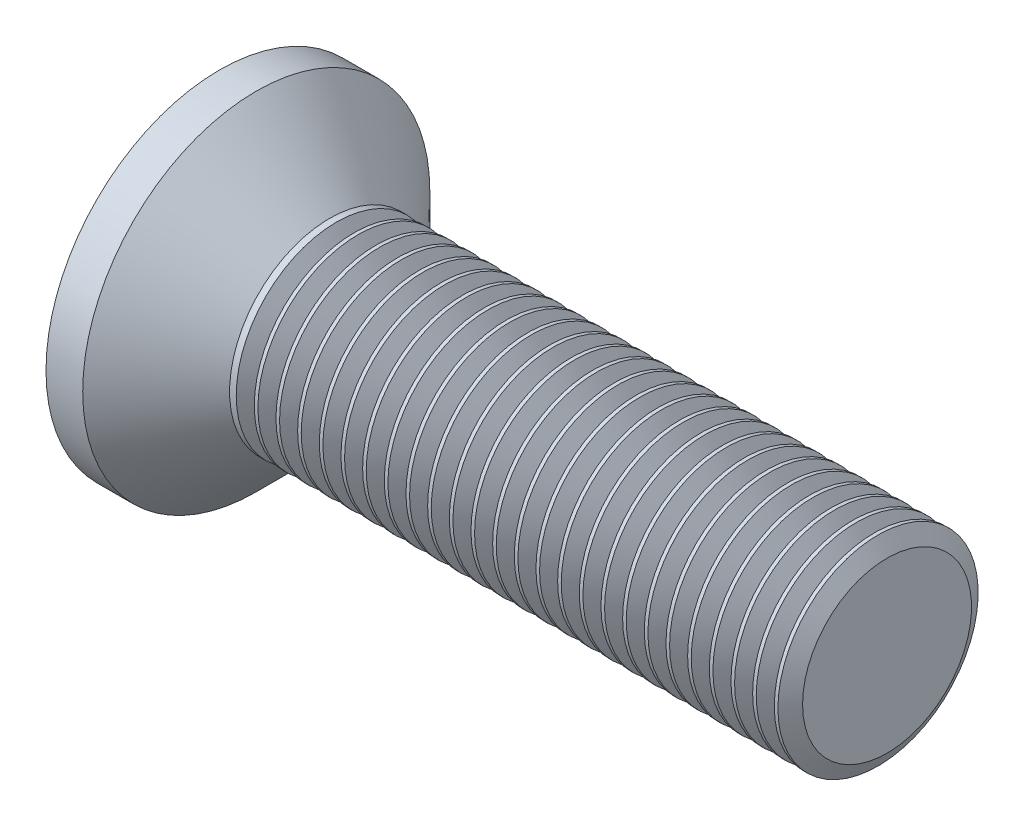
from build123d import *

# Parameters (mm, degrees)
CROSSRECESS_DEPTH = 0.825
DRAFT9_ANGLE      = 30
FILLET5_R         = 0.3
LPATTERN10_COUNT  = 26
LPATTERN10_PITCH  = 0.3246


with BuildPart() as part:
    # Sketch1 → Base (revolve)
    with BuildSketch(Plane.XY, mode=Mode.PRIVATE) as base_sk:
        Polygon((10, 1.5), (2.65, 1.5), (1.65, 1.5), (0.55, 2.6), (0, 2.6), (0, 0), (10, 0), align=None)
    revolve(base_sk.sketch.rotate(Axis((4.515812911, 0, 0), (-1, 0, 0)), 90), axis=Axis((4.515812911, 0, 0), (-1, 0, 0)))

    # Sketch6 → CrossRecess (cut)
    with BuildSketch(Plane(origin=(0, 0, 0), x_dir=(0, 0, -1), z_dir=(1, 0, 0))):
        Polygon((0.32, 0.32), (0.32, 1.6), (-0.32, 1.6), (-0.32, 0.32), (-1.6, 0.32), (-1.6, -0.32), (-0.32, -0.32), (-0.32, -1.6), (0.32, -1.6), (0.32, -0.32), (1.6, -0.32), (1.6, 0.32), align=None)
    extrude(amount=CROSSRECESS_DEPTH, mode=Mode.SUBTRACT)

    # Draft9
    draft9_faces = [part.faces().sort_by_distance(p)[0] for p in [
        (0.4125, 1.6, 0),
        (0.4125, 0, 1.6),
        (0.4125, -1.6, 0),
        (0.4125, 0, -1.6),
    ]]
    draft(draft9_faces, Plane(origin=(0, 2.6, 0), x_dir=(0, 0, -1), z_dir=(-1, 0, 0)), DRAFT9_ANGLE)

    # Fillet5
    fillet5_edges = [part.edges().sort_by_distance(p)[0] for p in [
        (0.4125, 0.32, 0.32),
        (0.4125, -0.32, 0.32),
        (0.4125, -0.32, -0.32),
        (0.4125, 0.32, -0.32),
    ]]
    fillet(fillet5_edges, radius=FILLET5_R)

    # Sketch9 → Cut-Revolve10 (revolve, cut)
    with BuildSketch(Plane.XY, mode=Mode.PRIVATE) as cut_revolve10_sk:
        Polygon((10, 1.265740128), (10.13525, 1.5), (10.13525, 1.7705), (9.86475, 1.7705), (9.86475, 1.5), align=None)
    cut_revolve10 = revolve(cut_revolve10_sk.sketch.rotate(Axis((0, 0, 0), (1, 0, 0)), 270), axis=Axis((0, 0, 0), (1, 0, 0)), mode=Mode.SUBTRACT)

    # LPattern10: Cut-Revolve10 ×26
    with Locations(*[(-i * LPATTERN10_PITCH, 0, 0) for i in range(1, LPATTERN10_COUNT)]):
        add(cut_revolve10, mode=Mode.SUBTRACT)


solid = part.part
